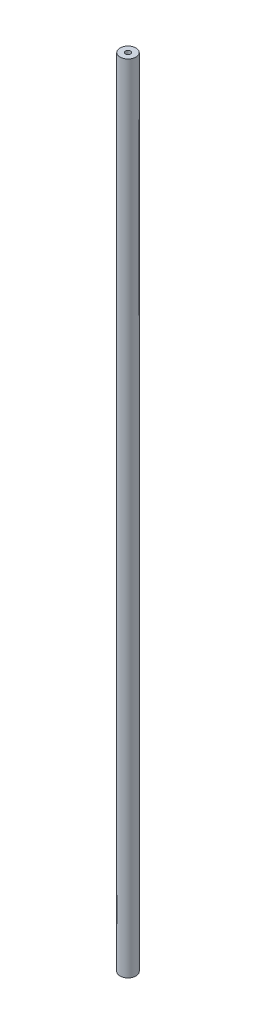
from build123d import *

# Parameters (mm, degrees)
SKETCH1_R                  = 6.35
BOSS_EXTRUDE1_DEPTH        = 634.492
F_10_32_TAPPED_HOLE1_D     = 4.0386
F_10_32_TAPPED_HOLE1_DEPTH = 12.02944
F_10_32_TAPPED_HOLE1_TIP   = 1.213317848
F_10_32_TAPPED_HOLE2_D     = 4.0386
F_10_32_TAPPED_HOLE2_DEPTH = 12.02944
F_10_32_TAPPED_HOLE2_TIP   = 1.213317848


with BuildPart() as part:
    # Sketch1 → Boss-Extrude1 (new body)
    with BuildSketch(Plane(origin=(0, 0, 0), x_dir=(1, 0, 0), z_dir=(0, 1, 0))):
        with Locations(Location((0, 0, 0), (0, 0, 270))):
            Circle(SKETCH1_R)
    extrude(amount=BOSS_EXTRUDE1_DEPTH)

    # #10-32 Tapped Hole1
    with Locations(Plane(origin=(0, 0, 0), x_dir=(-1, 0, 0), z_dir=(0, -1, 0))):
        with Locations((0, 0)):
            Hole(F_10_32_TAPPED_HOLE1_D / 2, depth=F_10_32_TAPPED_HOLE1_DEPTH)
            with Locations((0, 0, -(F_10_32_TAPPED_HOLE1_DEPTH + F_10_32_TAPPED_HOLE1_TIP / 2))):  # 118° drill point
                Cone(0, F_10_32_TAPPED_HOLE1_D / 2, F_10_32_TAPPED_HOLE1_TIP, mode=Mode.SUBTRACT)

    # #10-32 Tapped Hole2
    with Locations(Plane(origin=(0, 634.492, 0), x_dir=(1, 0, 0), z_dir=(0, 1, 0))):
        with Locations((0, 0)):
            Hole(F_10_32_TAPPED_HOLE2_D / 2, depth=F_10_32_TAPPED_HOLE2_DEPTH)
            with Locations((0, 0, -(F_10_32_TAPPED_HOLE2_DEPTH + F_10_32_TAPPED_HOLE2_TIP / 2))):  # 118° drill point
                Cone(0, F_10_32_TAPPED_HOLE2_D / 2, F_10_32_TAPPED_HOLE2_TIP, mode=Mode.SUBTRACT)


solid = part.part
